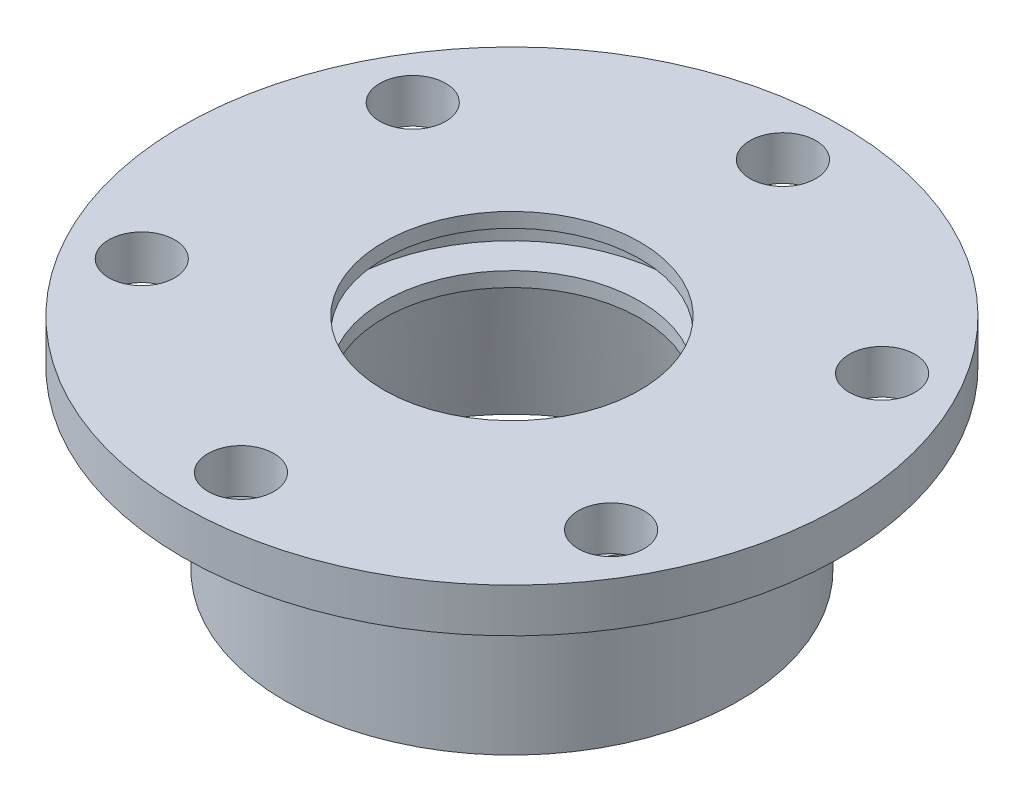
from build123d import *

# Parameters (mm, degrees)
CUT_EXTRUDE1_REACH = 72.356
SKETCH2_R          = 4.5


with BuildPart() as part:
    # Sketch1 → Revolve1 (revolve)
    with BuildSketch(Plane.XY, mode=Mode.PRIVATE) as revolve1_sk:
        Polygon((-45, 30), (-45, 24), (-29.5, 24), (-29.5, 22.5), (-31, 22.5), (-31, 0), (-26, 0), (-22.297133405, 21), (-17.5, 21), (-17.5, 23), (-22.5, 23), (-22.5, 28), (-17.5, 28), (-17.5, 30), (-27, 30), align=None)
    revolve(revolve1_sk.sketch.rotate(Axis((0, 30.618797564, 0), (0, -1, 0)), 270), axis=Axis((0, 30.618797564, 0), (0, -1, 0)))

    # Sketch2 → Cut-Extrude1 (cut, up to next)
    with BuildSketch(Plane(origin=(0, 30, 0), x_dir=(1, 0, 0), z_dir=(0, 1, 0)), mode=Mode.PRIVATE) as cut_extrude1_sk1:
        with Locations(Location((0, 37, 0), (0, 0, 270))):
            Circle(SKETCH2_R)
    cut_extrude1_tool1 = extrude(cut_extrude1_sk1.sketch, amount=-CUT_EXTRUDE1_REACH, mode=Mode.PRIVATE) & part.part
    # Sketch2 → Cut-Extrude1 (cut, up to next)
    with BuildSketch(Plane(origin=(0, 30, 0), x_dir=(1, 0, 0), z_dir=(0, 1, 0)), mode=Mode.PRIVATE) as cut_extrude1_sk2:
        with Locations(Location((32.04293994, 18.5, 0), (0, 0, 270))):
            Circle(SKETCH2_R)
    cut_extrude1_tool2 = extrude(cut_extrude1_sk2.sketch, amount=-CUT_EXTRUDE1_REACH, mode=Mode.PRIVATE) & part.part
    # Sketch2 → Cut-Extrude1 (cut, up to next)
    with BuildSketch(Plane(origin=(0, 30, 0), x_dir=(1, 0, 0), z_dir=(0, 1, 0)), mode=Mode.PRIVATE) as cut_extrude1_sk3:
        with Locations(Location((32.04293994, -18.5, 0), (0, 0, 270))):
            Circle(SKETCH2_R)
    cut_extrude1_tool3 = extrude(cut_extrude1_sk3.sketch, amount=-CUT_EXTRUDE1_REACH, mode=Mode.PRIVATE) & part.part
    # Sketch2 → Cut-Extrude1 (cut, up to next)
    with BuildSketch(Plane(origin=(0, 30, 0), x_dir=(1, 0, 0), z_dir=(0, 1, 0)), mode=Mode.PRIVATE) as cut_extrude1_sk4:
        with Locations(Location((0, -37, 0), (0, 0, 270))):
            Circle(SKETCH2_R)
    cut_extrude1_tool4 = extrude(cut_extrude1_sk4.sketch, amount=-CUT_EXTRUDE1_REACH, mode=Mode.PRIVATE) & part.part
    # Sketch2 → Cut-Extrude1 (cut, up to next)
    with BuildSketch(Plane(origin=(0, 30, 0), x_dir=(1, 0, 0), z_dir=(0, 1, 0)), mode=Mode.PRIVATE) as cut_extrude1_sk5:
        with Locations(Location((-32.04293994, -18.5, 0), (0, 0, 270))):
            Circle(SKETCH2_R)
    cut_extrude1_tool5 = extrude(cut_extrude1_sk5.sketch, amount=-CUT_EXTRUDE1_REACH, mode=Mode.PRIVATE) & part.part
    # Sketch2 → Cut-Extrude1 (cut, up to next)
    with BuildSketch(Plane(origin=(0, 30, 0), x_dir=(1, 0, 0), z_dir=(0, 1, 0)), mode=Mode.PRIVATE) as cut_extrude1_sk6:
        with Locations(Location((-32.04293994, 18.5, 0), (0, 0, 270))):
            Circle(SKETCH2_R)
    cut_extrude1_tool6 = extrude(cut_extrude1_sk6.sketch, amount=-CUT_EXTRUDE1_REACH, mode=Mode.PRIVATE) & part.part
    add(cut_extrude1_tool1.solids().sort_by_distance((0, 30, -37))[0], mode=Mode.SUBTRACT)
    add(cut_extrude1_tool2.solids().sort_by_distance((32.04294, 30, -18.5))[0], mode=Mode.SUBTRACT)
    add(cut_extrude1_tool3.solids().sort_by_distance((32.04294, 30, 18.5))[0], mode=Mode.SUBTRACT)
    add(cut_extrude1_tool4.solids().sort_by_distance((0, 30, 37))[0], mode=Mode.SUBTRACT)
    add(cut_extrude1_tool5.solids().sort_by_distance((-32.04294, 30, 18.5))[0], mode=Mode.SUBTRACT)
    add(cut_extrude1_tool6.solids().sort_by_distance((-32.04294, 30, -18.5))[0], mode=Mode.SUBTRACT)


solid = part.part
